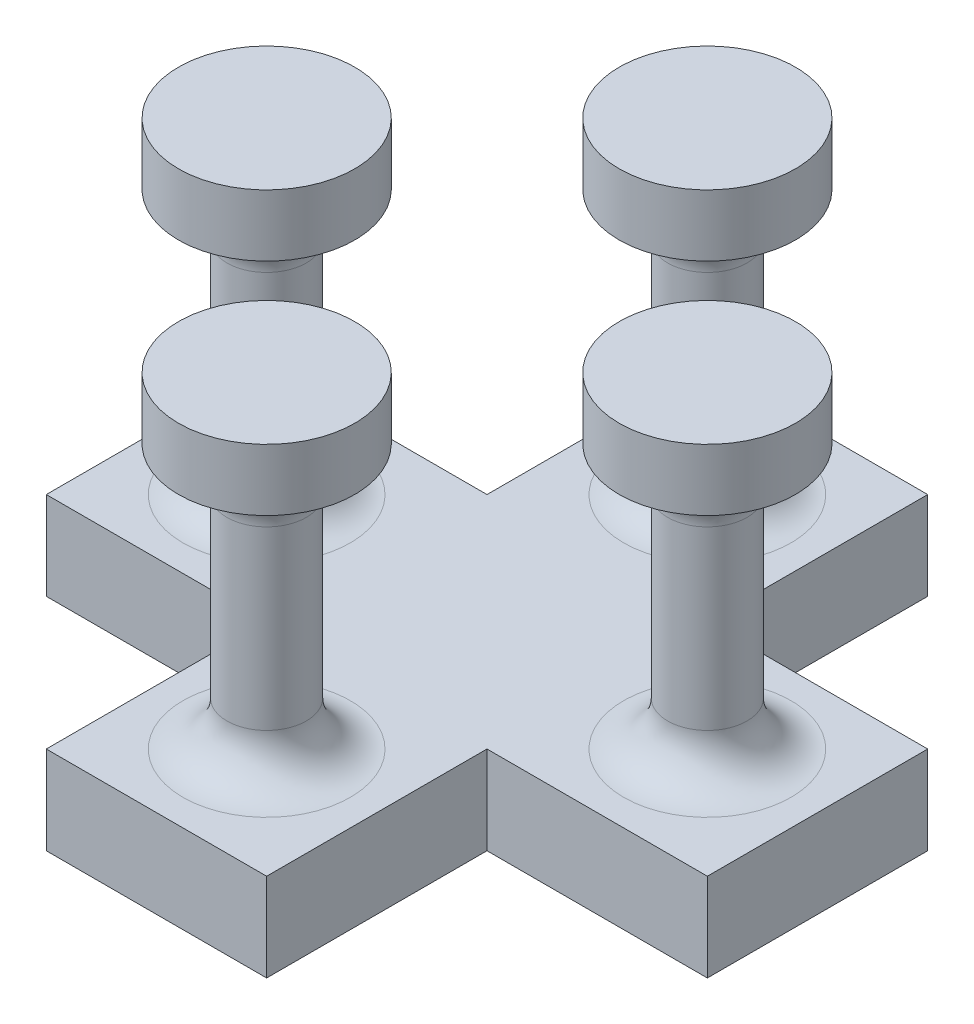
from build123d import *

# Parameters (mm, degrees)
BODY_DEPTH  = 2.54
SKETCH2_R   = 1.143
FLAG_DEPTH  = 7.62
SKETCH3_R   = 2.54
FEET_DEPTH  = 1.778
ROUNDNESS_R = 1.27


with BuildPart() as part:
    # Sketch1 → body (new body)
    with BuildSketch(Plane(origin=(0, 0, 0), x_dir=(1, 0, 0), z_dir=(0, 1, 0))):
        Polygon((-8.348684361, -10.452067183), (-8.348684361, -4.102067183), (-1.998684361, -4.102067183), (-1.998684361, -10.452067183), (4.351315639, -10.452067183), (4.351315639, -16.802067183), (-1.998684361, -16.802067183), (-1.998684361, -23.152067183), (-8.348684361, -23.152067183), (-8.348684361, -16.802067183), (-14.698684361, -16.802067183), (-14.698684361, -10.452067183), align=None)
    extrude(amount=BODY_DEPTH)

    # Sketch2 → flag (add)
    with BuildSketch(Plane(origin=(0, 2.54, 0), x_dir=(1, 0, 0), z_dir=(0, 1, 0))):
        with Locations(Location((-5.173684361, -7.277067183, 0), (0, 0, 90))):
            Circle(SKETCH2_R)
        with Locations(Location((1.176315639, -13.627067183, 0), (0, 0, 90))):
            Circle(SKETCH2_R)
        with Locations(Location((-5.173684361, -19.977067183, 0), (0, 0, 90))):
            Circle(SKETCH2_R)
        with Locations(Location((-11.523684361, -13.627067183, 0), (0, 0, 90))):
            Circle(SKETCH2_R)
    extrude(amount=FLAG_DEPTH)

    # Sketch3 → feet (add)
    with BuildSketch(Plane(origin=(0, 10.16, 0), x_dir=(1, 0, 0), z_dir=(0, 1, 0))):
        with Locations(Location((-5.173684361, -7.277067183, 0), (0, 0, 270))):
            Circle(SKETCH3_R)
        with Locations(Location((-11.523684361, -13.627067183, 0), (0, 0, 270))):
            Circle(SKETCH3_R)
        with Locations(Location((-5.173684361, -19.977067183, 0), (0, 0, 270))):
            Circle(SKETCH3_R)
        with Locations(Location((1.176315639, -13.627067183, 0), (0, 0, 270))):
            Circle(SKETCH3_R)
    extrude(amount=FEET_DEPTH)

    # roundness
    roundness_edges = [part.edges().sort_by_distance(p)[0] for p in [
        (-5.173684361, 2.54, 8.420067183),
        (-5.173684361, 10.16, 8.420067183),
        (1.176315639, 2.54, 14.770067183),
        (1.176315639, 10.16, 14.770067183),
        (-5.173684361, 2.54, 21.120067183),
        (-5.173684361, 10.16, 21.120067183),
        (-11.523684361, 2.54, 14.770067183),
        (-11.523684361, 10.16, 14.770067183),
    ]]
    fillet(roundness_edges, radius=ROUNDNESS_R)


solid = part.part
